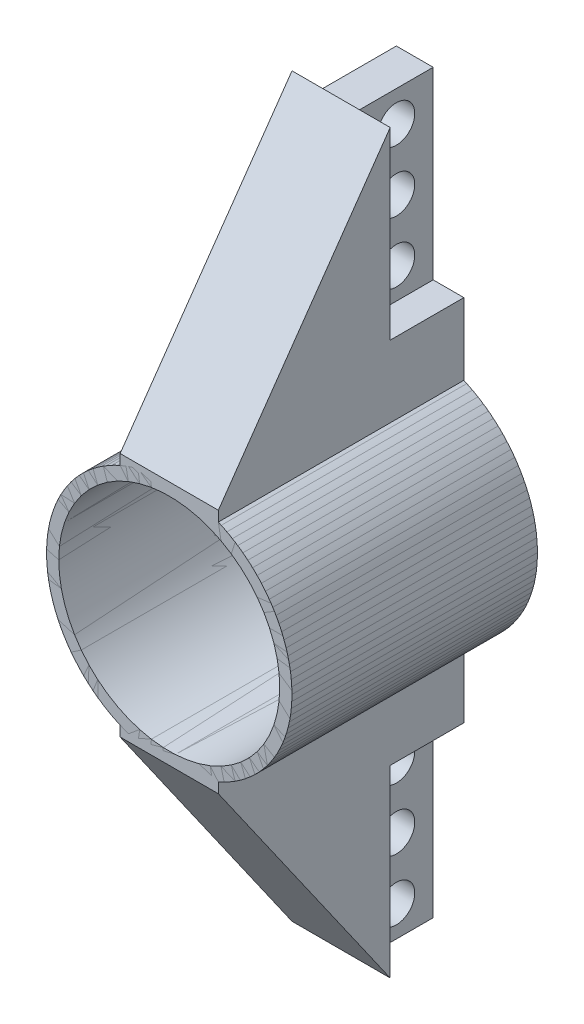
from build123d import *

# Parameters (mm, degrees)
SKETCH1_R             = 10
SKETCH1_R_2           = 9
BOSS_EXTRUDE1_DEPTH   = 20
BOSS_EXTRUDE2_DEPTH   = 4
SKETCH3_W             = 2.5
SKETCH3_H             = 6
CUT_EXTRUDE1_DEPTH    = 15
BODY_MOVE_COPY1_ANGLE = 180
SKETCH4_R             = 9
CUT_EXTRUDE2_DEPTH    = 38.416573868
SKETCH6_R             = 1.5
CUT_EXTRUDE3_DEPTH    = 38.84507894
SKETCH7_R             = 1.5
CUT_EXTRUDE4_DEPTH    = 38.84507894


with BuildPart() as part:
    # Sketch1 → Boss-Extrude1 (new body)
    with BuildSketch(Plane.XY):
        Circle(SKETCH1_R)
        Circle(SKETCH1_R_2, mode=Mode.SUBTRACT)
    extrude(amount=BOSS_EXTRUDE1_DEPTH)

    # Sketch2 → Boss-Extrude2 (add, symmetric)
    with BuildSketch(Plane(origin=(0, 0, 0), x_dir=(0, 0, -1), z_dir=(1, 0, 0))):
        Polygon((-20, 10), (-20, 6.5), (0, 6.5), (0, 30), (-6, 30), align=None)
    extrude(amount=BOSS_EXTRUDE2_DEPTH, both=True)

    # Sketch3 → Cut-Extrude1 (cut)
    with BuildSketch(Plane(origin=(0, 30, 0), x_dir=(1, 0, 0), z_dir=(0, 1, 0))):
        with Locations((-2.75, -3)):
            Rectangle(SKETCH3_W, SKETCH3_H)
        with Locations((2.75, -3)):
            Rectangle(SKETCH3_W, SKETCH3_H)
    extrude(amount=-CUT_EXTRUDE1_DEPTH, mode=Mode.SUBTRACT)


with BuildPart() as body_2:
    # Body-Move/Copy1: copy of part
    add(part.part.rotate(Axis((0, 0, 0), (0, 0, 1)), BODY_MOVE_COPY1_ANGLE))


with BuildPart() as cut_extrude2_tool:
    # Sketch4 → Cut-Extrude2 (new, through all)
    with BuildSketch(Plane(origin=(0, 0, 0), x_dir=(-1, 0, 0), z_dir=(0, 0, -1))):
        Circle(SKETCH4_R)
    extrude(amount=-CUT_EXTRUDE2_DEPTH)


with BuildPart() as part_1:
    add(part.part)

    # Cut-Extrude2: cut by cut_extrude2_tool
    add(cut_extrude2_tool.part, mode=Mode.SUBTRACT)

    # Sketch6 → Cut-Extrude3 (cut, through all)
    with BuildSketch(Plane.ZY.offset(1.5)):
        with Locations((3, 17.5)):
            Circle(SKETCH6_R)
        with Locations((3, 22.5)):
            Circle(SKETCH6_R)
        with Locations((3, 27.5)):
            Circle(SKETCH6_R)
    extrude(amount=-CUT_EXTRUDE3_DEPTH, mode=Mode.SUBTRACT)


with BuildPart() as body_2_1:
    add(body_2.part)

    # Cut-Extrude2: cut by cut_extrude2_tool
    add(cut_extrude2_tool.part, mode=Mode.SUBTRACT)

    # Sketch7 → Cut-Extrude4 (cut, through all)
    with BuildSketch(Plane.ZY.offset(1.5)):
        with Locations(Location((3, -17.5, 0), (0, 0, 270))):
            Circle(SKETCH7_R)
        with Locations(Location((3, -22.5, 0), (0, 0, 270))):
            Circle(SKETCH7_R)
        with Locations(Location((3, -27.5, 0), (0, 0, 270))):
            Circle(SKETCH7_R)
    extrude(amount=-CUT_EXTRUDE4_DEPTH, mode=Mode.SUBTRACT)


solid = Compound([part_1.part, body_2_1.part])
